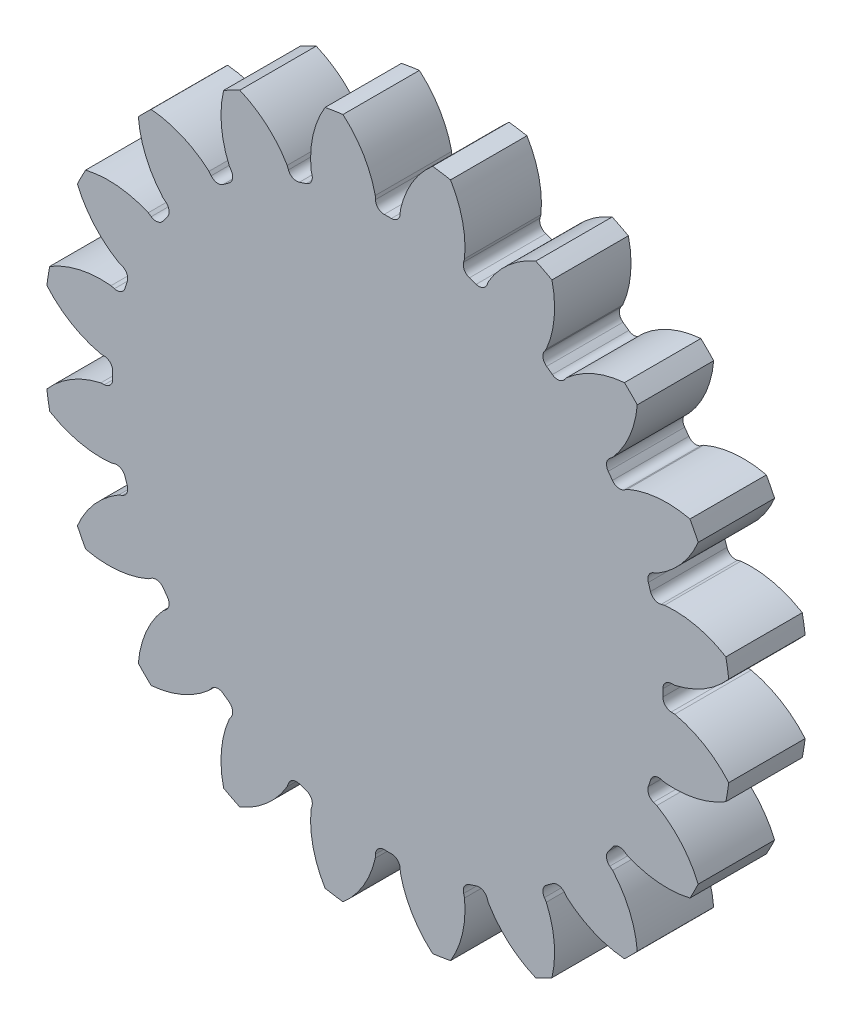
from build123d import *

# Parameters (mm, degrees)
SKETCH1_R                = 22.5
DF_CIRCLE_DEPTH          = 2.5
ONE_TEETH_DEPTH          = 32.917863337
FILLET1_R                = 0.57
CIRPATTERN1_COUNT        = 20
FILLET1_OF_CIRPATTERN1_R = 0.57


with BuildPart() as part:
    # Sketch1 → Df circle (new, symmetric)
    with BuildSketch(Plane.XY):
        Circle(SKETCH1_R)
    extrude(amount=DF_CIRCLE_DEPTH, both=True)

    # Sketch → one teeth (cut, symmetric)
    with BuildSketch(Plane.XY):
        with BuildLine():
            Line((0.78574949, 17.982841759), (0.82040333, 18.775937447))
            ThreePointArc((0.82040333, 18.775937447), (1.590807237, 20.712832367), (2.932556925, 22.308072751))
            ThreePointArc((2.932556925, 22.308072751), (0, 22.5), (-2.932556925, 22.308072751))
            ThreePointArc((-2.932556925, 22.308072751), (-1.590807237, 20.712832367), (-0.82040333, 18.775937447))
            Line((-0.82040333, 18.775937447), (-0.78574949, 17.982841759))
            ThreePointArc((-0.78574949, 17.982841759), (0, 18), (0.78574949, 17.982841759))
        make_face()
    one_teeth = extrude(amount=ONE_TEETH_DEPTH, both=True, mode=Mode.SUBTRACT)

    # Fillet1
    fillet1_edges = [part.edges().sort_by_distance(p)[0] for p in [
        (-0.78574949, 17.982841759, 0),
        (0.78574949, 17.982841759, 0),
    ]]
    fillet(fillet1_edges, radius=FILLET1_R)

    # CirPattern1: one teeth ×20 about axis
    cirpattern1_axis = Axis((0, 0, -2.5), (0, 0, 1))
    for i in range(1, CIRPATTERN1_COUNT):
        add(one_teeth.rotate(cirpattern1_axis, i * 360 / CIRPATTERN1_COUNT), mode=Mode.SUBTRACT)

    # Fillet1 of CirPattern1
    fillet1_of_cirpattern1_edges = [part.edges().sort_by_distance(p)[0] for p in [
        (-6.304295883, 16.859888891, 0),
        (-4.809711539, 17.345508782, 0),
        (-11.205733871, 14.086572628, 0),
        (-9.93436449, 15.010276552, 0),
        (-15.010276552, 9.93436449, 0),
        (-14.086572628, 11.205733871, 0),
        (-17.345508782, 4.809711539, 0),
        (-16.859888891, 6.304295883, 0),
        (-17.982841759, -0.78574949, 0),
        (-17.982841759, 0.78574949, 0),
        (-16.859888891, -6.304295883, 0),
        (-17.345508782, -4.809711539, 0),
        (-14.086572628, -11.205733871, 0),
        (-15.010276552, -9.93436449, 0),
        (-9.93436449, -15.010276552, 0),
        (-11.205733871, -14.086572628, 0),
        (-4.809711539, -17.345508782, 0),
        (-6.304295883, -16.859888891, 0),
        (0.78574949, -17.982841759, 0),
        (-0.78574949, -17.982841759, 0),
        (6.304295883, -16.859888891, 0),
        (4.809711539, -17.345508782, 0),
        (11.205733871, -14.086572628, 0),
        (9.93436449, -15.010276552, 0),
        (15.010276552, -9.93436449, 0),
        (14.086572628, -11.205733871, 0),
        (17.345508782, -4.809711539, 0),
        (16.859888891, -6.304295883, 0),
        (17.982841759, 0.78574949, 0),
        (17.982841759, -0.78574949, 0),
        (16.859888891, 6.304295883, 0),
        (17.345508782, 4.809711539, 0),
        (14.086572628, 11.205733871, 0),
        (15.010276552, 9.93436449, 0),
        (9.93436449, 15.010276552, 0),
        (11.205733871, 14.086572628, 0),
        (4.809711539, 17.345508782, 0),
        (6.304295883, 16.859888891, 0),
    ]]
    fillet(fillet1_of_cirpattern1_edges, radius=FILLET1_OF_CIRPATTERN1_R)


solid = part.part
